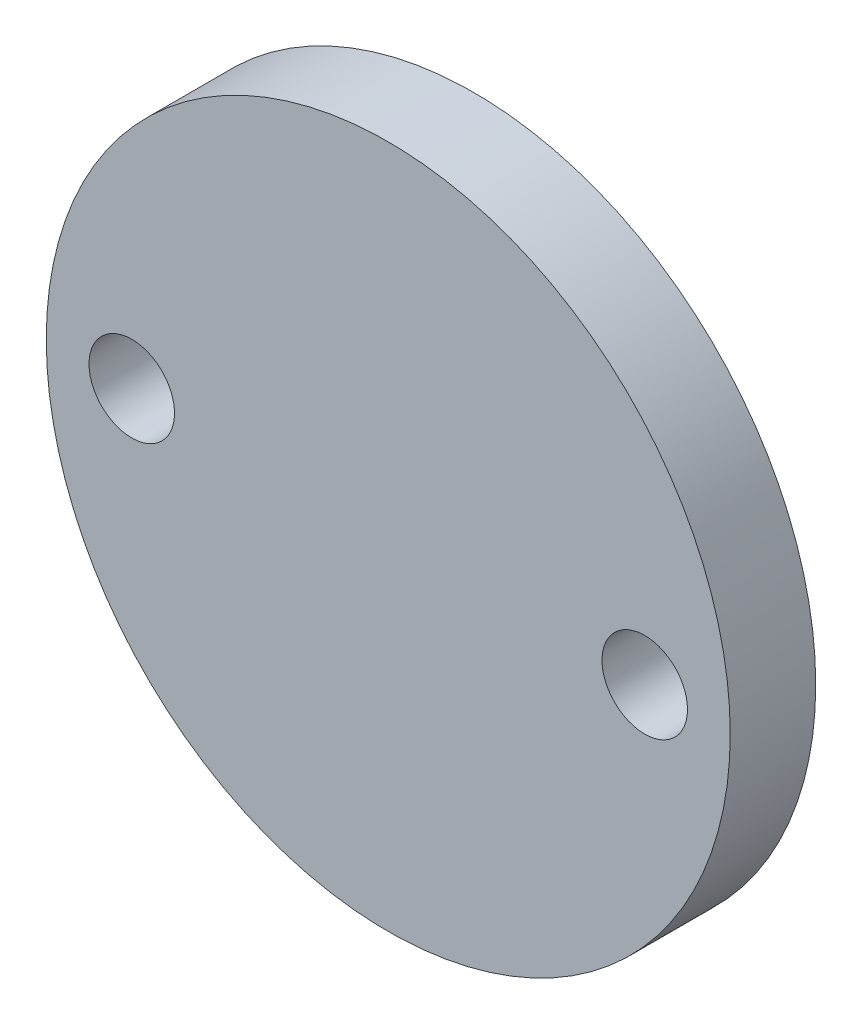
from build123d import *

# Parameters (mm, degrees)
SKETCH1_R           = 40
SKETCH1_R_2         = 5
BOSS_EXTRUDE1_DEPTH = 10


with BuildPart() as part:
    # Sketch1 → Boss-Extrude1 (new body)
    with BuildSketch(Plane.XY):
        Circle(SKETCH1_R)
        with Locations((30, 0)):
            Circle(SKETCH1_R_2, mode=Mode.SUBTRACT)
        with Locations(Location((-30, 0, 0), (0, 0, 180))):
            Circle(SKETCH1_R_2, mode=Mode.SUBTRACT)
    extrude(amount=BOSS_EXTRUDE1_DEPTH)


solid = part.part
